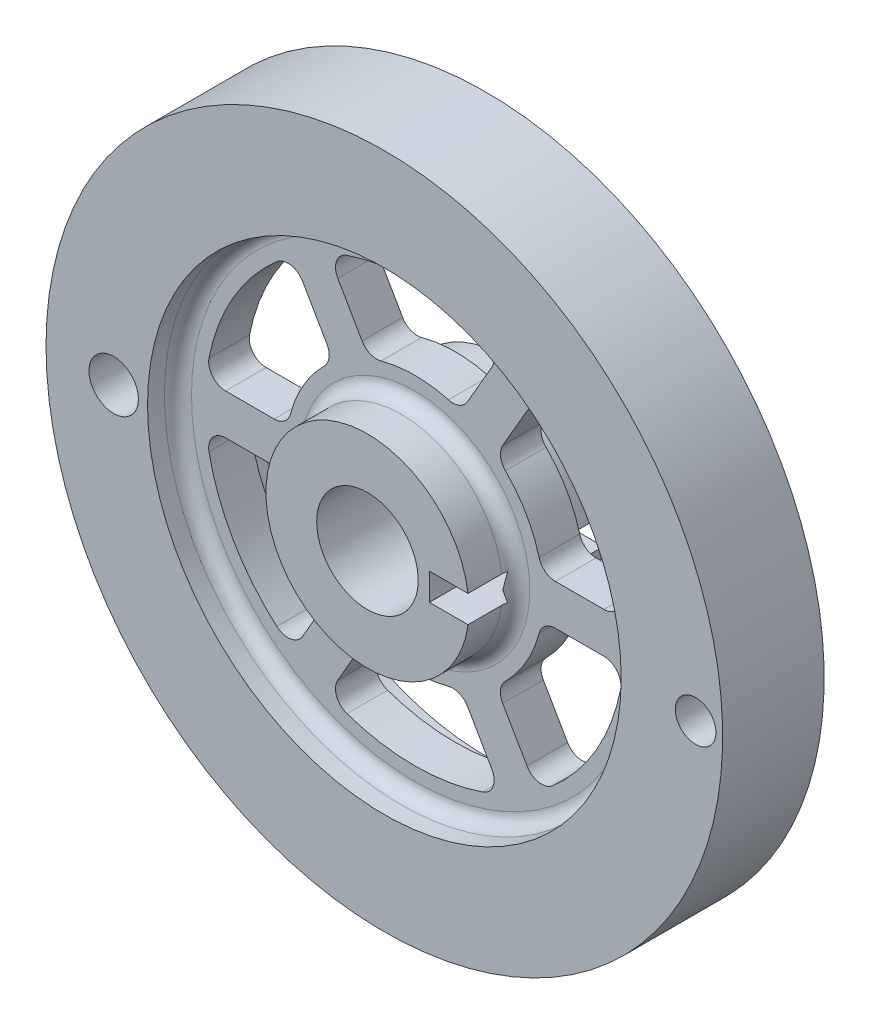
from build123d import *

# Parameters (mm, degrees)
FILLET_1_R               = 4
CUT_EXTRUDE_3_DEPTH      = 6
PATTERN_CIRCULAR_1_COUNT = 6
FILLET_2_R               = 5
SKETCH_6_W               = 11.7
SKETCH_6_H               = 8
CUT_EXTRUDE_6_DEPTH      = 147.969384567
SKETCH_7_R               = 6
CUT_EXTRUDE_7_DEPTH      = 146.688022867
SKETCH_8_R               = 7.3005
CUT_EXTRUDE_8_DEPTH      = 201
FILLET_3_R               = 5


with BuildPart() as part:
    # 草图1 → 旋转1 (revolve)
    with BuildSketch(Plane(origin=(0, 0, 0), x_dir=(1, 0, 0), z_dir=(0, 1, 0))):
        Polygon((15, 20), (30, 20), (30, 6), (70, 6), (70, 15), (100, 15), (100, -15), (70, -15), (70, -6), (30, -6), (30, -20), (15, -20), align=None)
    revolve(axis=Axis((0, 0, -20), (0, 0, 1)))

    # 圆角1
    fillet_1_edges = [part.edges().sort_by_distance(p)[0] for p in [
        (-70, 0, -6),
        (-30, 0, -6),
        (-70, 0, 6),
        (-30, 0, 6),
    ]]
    fillet(fillet_1_edges, radius=FILLET_1_R)

    # 草图4 → 切除-拉伸3 (cut, symmetric)
    with BuildSketch(Plane.XY):
        with BuildLine():
            Line((23.9577, 29.4953), (36.0505, 50.4402))
            ThreePointArc((36.0505, 50.4402), (53.693293556, 30.999302329), (61.709, 6))
            Line((61.709, 6), (37.5233, 6))
            ThreePointArc((37.5233, 6), (32.909086895, 18.999737966), (23.9577, 29.4953))
        make_face()
    cut_extrude_3 = extrude(amount=CUT_EXTRUDE_3_DEPTH, both=True, mode=Mode.SUBTRACT)

    # 阵列(圆周)1: 切除-拉伸3 ×6 about axis
    pattern_circular_1_axis = Axis((0, 0, 22), (0, 0, -1))
    for i in range(1, PATTERN_CIRCULAR_1_COUNT):
        add(cut_extrude_3.rotate(pattern_circular_1_axis, i * 360 / PATTERN_CIRCULAR_1_COUNT), mode=Mode.SUBTRACT)

    # 圆角2
    fillet_2_edges = [part.edges().sort_by_distance(p)[0] for p in [
        (36.050652423, -50.441561642, 0),
        (61.707744572, -6.000548819, 0),
        (-25.658347577, -56.441561642, 0),
        (25.657244572, -56.440748819, 0),
        (23.957802423, -29.496131034, 0),
        (-61.709, -6, 0),
        (-36.0505, -50.4402, 0),
        (-13.565497577, -35.496131034, 0),
        (-36.050652423, 50.441561642, 0),
        (-61.707744572, 6.000548819, 0),
        (-37.5233, -6, 0),
        (25.658347577, 56.441561642, 0),
        (-25.657244572, 56.440748819, 0),
        (-23.957802423, 29.496131034, 0),
        (61.709, 6, 0),
        (36.0505, 50.4402, 0),
        (13.565497577, 35.496131034, 0),
        (37.5233, 6, 0),
    ]]
    fillet(fillet_2_edges, radius=FILLET_2_R)

    # 草图6 → 切除-拉伸6 (cut, through all)
    with BuildSketch(Plane.XY.offset(20)):
        with Locations((24.15, 0)):
            Rectangle(SKETCH_6_W, SKETCH_6_H)
    extrude(amount=-CUT_EXTRUDE_6_DEPTH, mode=Mode.SUBTRACT)

    # 草图7 → 切除-拉伸7 (cut, through all)
    with BuildSketch(Plane.XY.offset(15)):
        with Locations((92, 0)):
            Circle(SKETCH_7_R)
    extrude(amount=-CUT_EXTRUDE_7_DEPTH, mode=Mode.SUBTRACT)

    # 草图8 → 切除-拉伸8 (cut, symmetric)
    with BuildSketch(Plane.XY):
        with Locations((-80, 0)):
            Circle(SKETCH_8_R)
    extrude(amount=CUT_EXTRUDE_8_DEPTH, both=True, mode=Mode.SUBTRACT)

    # 圆角3
    fillet_3_edges = [part.edges().sort_by_distance(p)[0] for p in [
        (37.522529092, -6.000326816, 0),
        (13.564829092, -35.495626816, 0),
        (-23.9577, -29.4953, 0),
        (-37.522529092, 6.000326816, 0),
        (-13.564829092, 35.495626816, 0),
        (23.9577, 29.4953, 0),
    ]]
    fillet(fillet_3_edges, radius=FILLET_3_R)


solid = part.part
